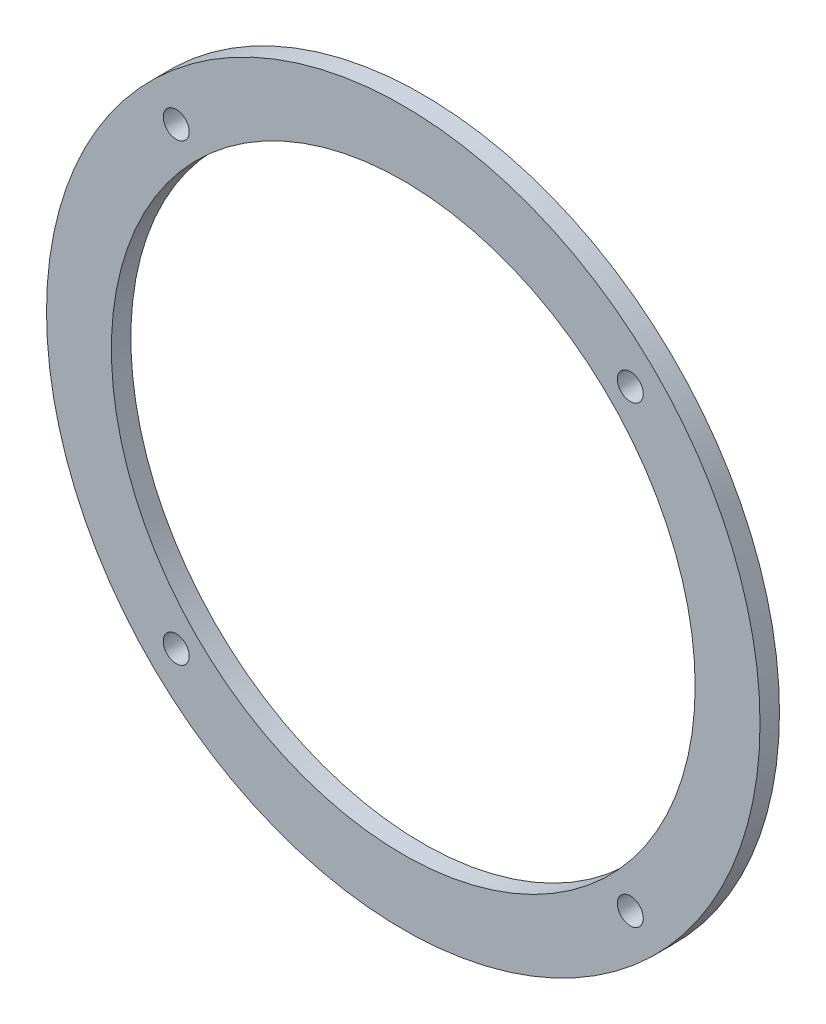
from build123d import *

# Parameters (mm, degrees)
SKETCH_1_R      = 55
SKETCH_1_R_2    = 45
SKETCH_1_R_3    = 2
EXTRUDE_1_DEPTH = 3


with BuildPart() as part:
    # 草图1 → 凸台-拉伸1 (new body)
    with BuildSketch(Plane.XY):
        Circle(SKETCH_1_R)
        Circle(SKETCH_1_R_2, mode=Mode.SUBTRACT)
        with Locations((-35.001785669, 35.001785669)):
            Circle(SKETCH_1_R_3, mode=Mode.SUBTRACT)
        with Locations((35.001785669, 35.001785669)):
            Circle(SKETCH_1_R_3, mode=Mode.SUBTRACT)
        with Locations((35.001785669, -35.001785669)):
            Circle(SKETCH_1_R_3, mode=Mode.SUBTRACT)
        with Locations((-35.001785669, -35.001785669)):
            Circle(SKETCH_1_R_3, mode=Mode.SUBTRACT)
    extrude(amount=EXTRUDE_1_DEPTH)


solid = part.part
